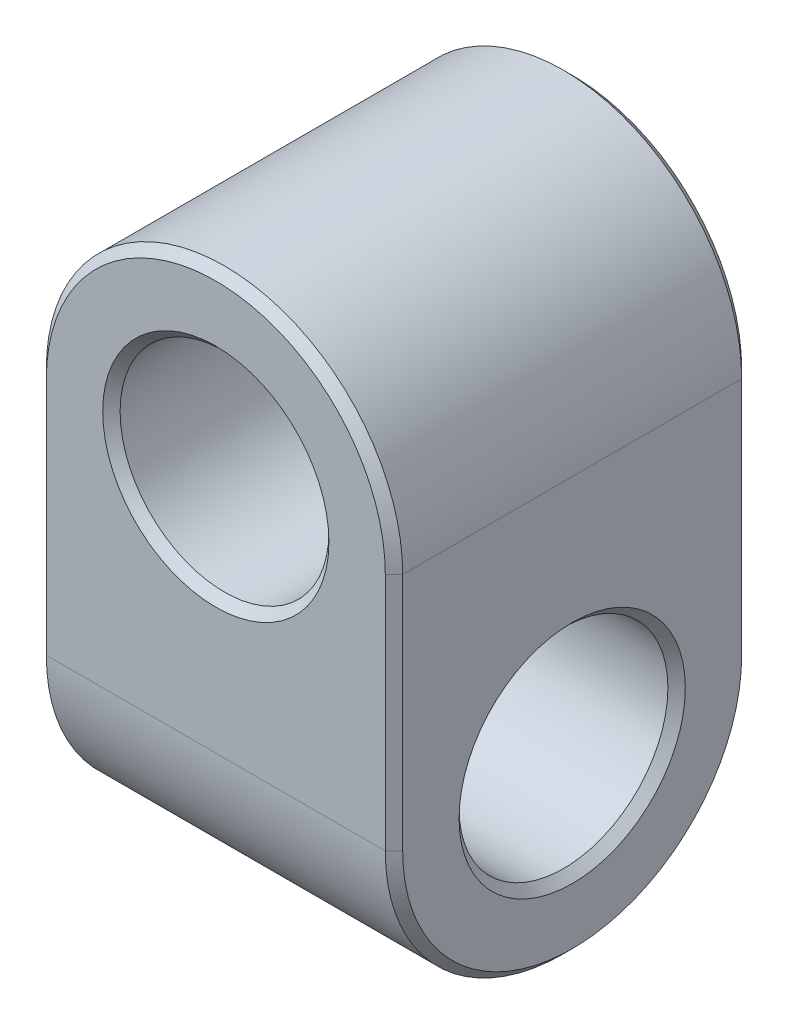
from build123d import *

# Parameters (mm, degrees)
SKETCH1_R           = 4.7625
BOSS_EXTRUDE1_DEPTH = 16.256
SKETCH2_R           = 4.7625
CUT_EXTRUDE1_DEPTH  = 16.256
CHAMFER1_SIZE       = 0.396875


with BuildPart() as part:
    # Sketch1 → Boss-Extrude1 (new body)
    with BuildSketch(Plane.XY):
        with BuildLine():
            Line((-8.128, 9.525), (-8.128, -9.525))
            Line((-8.128, -9.525), (8.128, -9.525))
            Line((8.128, -9.525), (8.128, 9.525))
            ThreePointArc((8.128, 9.525), (0, 17.653), (-8.128, 9.525))
        make_face()
        with Locations((0, 9.525)):
            Circle(SKETCH1_R, mode=Mode.SUBTRACT)
    extrude(amount=BOSS_EXTRUDE1_DEPTH)

    # Sketch2 → Cut-Extrude1 (cut)
    with BuildSketch(Plane(origin=(8.128, 0, 0), x_dir=(0, 0, -1), z_dir=(1, 0, 0))):
        with BuildLine():
            ThreePointArc((0, -1.397), (-2.380636089, -7.144363924), (-8.128000019, -9.525))
            Line((-8.128000019, -9.525), (0, -9.525))
            Line((0, -9.525), (0, -1.397))
        make_face()
        with BuildLine():
            ThreePointArc((-8.128000019, -9.525), (-13.875363924, -7.144363911), (-16.256, -1.397))
            Line((-16.256, -1.397), (-16.256, -9.525))
            Line((-16.256, -9.525), (-8.128000019, -9.525))
        make_face()
        with Locations(Location((-8.128, -1.397, 0), (0, 0, 90))):
            Circle(SKETCH2_R)
    extrude(amount=-CUT_EXTRUDE1_DEPTH, mode=Mode.SUBTRACT)

    # Chamfer1
    chamfer1_edges = [part.edges().sort_by_distance(p)[0] for p in [
        (-4.7625, 9.525, 16.256),
        (-8.128, 4.064, 16.256),
        (8.128, 4.064, 16.256),
        (8.128, -9.525, 8.128),
        (-8.128, -9.525, 8.128),
        (8.128, 4.064, 0),
        (8.128, -6.1595, 8.128),
        (-8.128, -6.1595, 8.128),
        (-8.128, 4.064, 0),
        (0, 17.653, 0),
        (0, 17.653, 16.256),
    ]]
    chamfer(chamfer1_edges, length=CHAMFER1_SIZE)


solid = part.part
